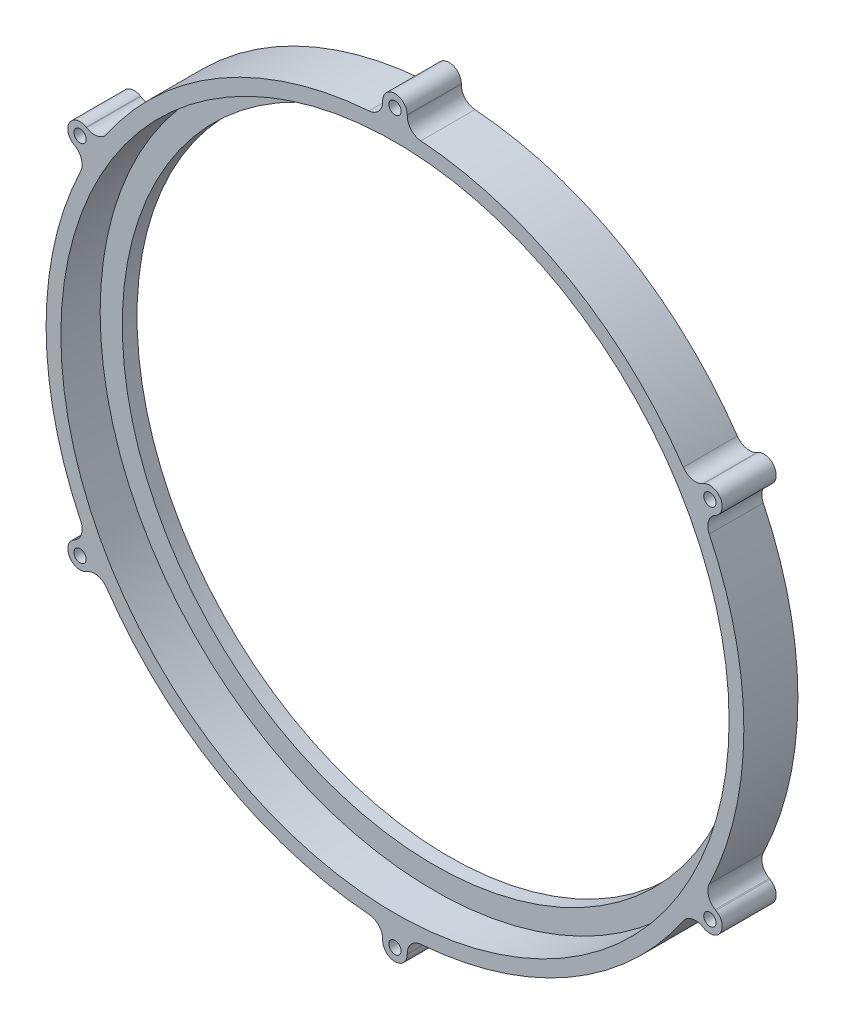
from build123d import *

# Parameters (mm, degrees)
SKETCH_1_R      = 71
SKETCH_1_R_2    = 63.5
EXTRUDE_1_DEPTH = 3
SKETCH_2_R      = 71
SKETCH_2_R_2    = 68
EXTRUDE_2_DEPTH = 8
EXTRUDE_START   = -11
SKETCH_3_R      = 1.25
EXTRUDE_3_DEPTH = 11
FILLET_2_R      = 3


with BuildPart() as part:
    # 草图1 → 凸台-拉伸1 (new body)
    with BuildSketch(Plane.XY):
        Circle(SKETCH_1_R)
        Circle(SKETCH_1_R_2, mode=Mode.SUBTRACT)
    extrude(amount=EXTRUDE_1_DEPTH)

    # 草图2 → 凸台-拉伸2 (add)
    with BuildSketch(Plane.XY.offset(3)):
        Circle(SKETCH_2_R)
        Circle(SKETCH_2_R_2, mode=Mode.SUBTRACT)
    extrude(amount=EXTRUDE_2_DEPTH)

    # 草图3 → 凸台-拉伸3 (add)
    # profile 1 of 6: a face of its own
    with BuildSketch(Plane.XY.offset(11).offset(EXTRUDE_START)):
        with BuildLine():
            ThreePointArc((2.5, 74), (0, 76.5), (-2.5, 74))
            Line((-2.5, 74), (-2.5, 70.955972264))
            ThreePointArc((-2.5, 70.955972264), (-0.051390082, 70.999981402), (2.397280978, 70.959516937))
            Line((2.397280978, 70.959516937), (2.5, 74))
        make_face()
        with Locations((0, 74)):
            Circle(SKETCH_3_R, mode=Mode.SUBTRACT)
    # profile 2 of 6: a face of its own
    with BuildSketch(Plane.XY.offset(11).offset(EXTRUDE_START)):
        with BuildLine():
            ThreePointArc((65.33587988, 34.834936491), (66.25094339, 38.25), (62.83587988, 39.165063509))
            Line((62.83587988, 39.165063509), (60.199674531, 37.643049642))
            ThreePointArc((60.199674531, 37.643049642), (61.462092521, 35.544495818), (62.651384796, 33.403652242))
            Line((62.651384796, 33.403652242), (65.33587988, 34.834936491))
        make_face()
        with Locations((64.08587988, 37)):
            Circle(SKETCH_3_R, mode=Mode.SUBTRACT)
    # profile 3 of 6: a face of its own
    with BuildSketch(Plane.XY.offset(11).offset(EXTRUDE_START)):
        with BuildLine():
            ThreePointArc((62.83587988, -39.165063509), (66.25094339, -38.25), (65.33587988, -34.834936491))
            Line((65.33587988, -34.834936491), (62.699674531, -33.312922623))
            ThreePointArc((62.699674531, -33.312922623), (61.513482603, -35.455485584), (60.254103819, -37.555864695))
            Line((60.254103819, -37.555864695), (62.83587988, -39.165063509))
        make_face()
        with Locations((64.08587988, -37)):
            Circle(SKETCH_3_R, mode=Mode.SUBTRACT)
    # profile 4 of 6: a face of its own
    with BuildSketch(Plane.XY.offset(11).offset(EXTRUDE_START)):
        with BuildLine():
            ThreePointArc((-2.5, -74), (0, -76.5), (2.5, -74))
            Line((2.5, -74), (2.5, -70.955972264))
            ThreePointArc((2.5, -70.955972264), (0.051390082, -70.999981402), (-2.397280978, -70.959516937))
            Line((-2.397280978, -70.959516937), (-2.5, -74))
        make_face()
        with Locations((0, -74)):
            Circle(SKETCH_3_R, mode=Mode.SUBTRACT)
    # profile 5 of 6: a face of its own
    with BuildSketch(Plane.XY.offset(11).offset(EXTRUDE_START)):
        with BuildLine():
            ThreePointArc((-65.33587988, -34.834936491), (-66.25094339, -38.25), (-62.83587988, -39.165063509))
            Line((-62.83587988, -39.165063509), (-60.199674531, -37.643049642))
            ThreePointArc((-60.199674531, -37.643049642), (-61.462092521, -35.544495818), (-62.651384796, -33.403652242))
            Line((-62.651384796, -33.403652242), (-65.33587988, -34.834936491))
        make_face()
        with Locations((-64.08587988, -37)):
            Circle(SKETCH_3_R, mode=Mode.SUBTRACT)
    # profile 6 of 6: a face of its own
    with BuildSketch(Plane.XY.offset(11).offset(EXTRUDE_START)):
        with BuildLine():
            ThreePointArc((-62.83587988, 39.165063509), (-66.25094339, 38.25), (-65.33587988, 34.834936491))
            Line((-65.33587988, 34.834936491), (-62.699674531, 33.312922623))
            ThreePointArc((-62.699674531, 33.312922623), (-61.513482603, 35.455485584), (-60.254103819, 37.555864695))
            Line((-60.254103819, 37.555864695), (-62.83587988, 39.165063509))
        make_face()
        with Locations((-64.08587988, 37)):
            Circle(SKETCH_3_R, mode=Mode.SUBTRACT)
    extrude(amount=EXTRUDE_3_DEPTH)

    # 圆角2
    fillet_2_edges = [part.edges().sort_by_distance(p)[0] for p in [
        (60.254103819, -37.555864695, 5.5),
        (62.699674531, -33.312922623, 5.5),
        (-2.397280978, -70.959516937, 5.5),
        (2.5, -70.955972264, 5.5),
        (-62.651384796, -33.403652242, 5.5),
        (-60.199674531, -37.643049642, 5.5),
        (-60.254103819, 37.555864695, 5.5),
        (-62.699674531, 33.312922623, 5.5),
        (2.397280978, 70.959516937, 5.5),
        (-2.5, 70.955972264, 5.5),
        (62.651384796, 33.403652242, 5.5),
        (60.199674531, 37.643049642, 5.5),
    ]]
    fillet(fillet_2_edges, radius=FILLET_2_R)


solid = part.part
